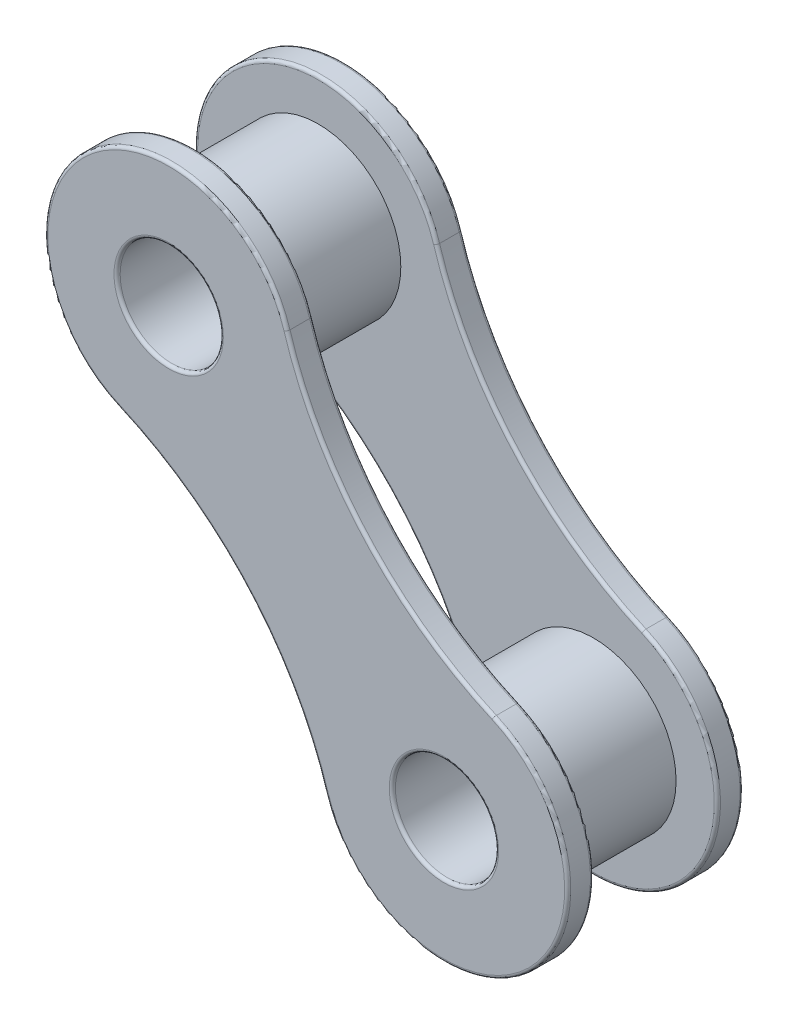
from build123d import *

# Parameters (mm, degrees)
SKETCH_4_R        = 4
SKETCH_4_R_2      = 2.5
EXTRUDE_1_DEPTH   = 3
EXTRUDE_1_2_DEPTH = 3
SKETCH_5_R        = 2.5
EXTRUDE_2_DEPTH   = 1.25
FILLET_1_R        = 0.15


with BuildPart() as part:
    # Эскиз4 → Бобышка-Вытянуть1 (new, symmetric)
    with BuildSketch(Plane.XY):
        with Locations((45.153479747, 53.838446064)):
            Circle(SKETCH_4_R)
        with Locations((45.153479747, 53.838446064)):
            Circle(SKETCH_4_R_2, mode=Mode.SUBTRACT)
    extrude(amount=EXTRUDE_1_DEPTH, both=True)



with BuildPart() as body_2:
    # Эскиз4 → Extrude 1 2 (new, symmetric)
    with BuildSketch(Plane.XY):
        with Locations((58.492489618, 38.936405409)):
            Circle(SKETCH_4_R)
        with Locations((58.492489618, 38.936405409)):
            Circle(SKETCH_4_R_2, mode=Mode.SUBTRACT)
    extrude(amount=EXTRUDE_1_2_DEPTH, both=True)


with BuildPart() as part_1:
    add(part.part)

    add(body_2.part)  # Бобышка-Вытянуть2 merges body 2
    # Эскиз5 → Бобышка-Вытянуть2 (add)
    with BuildSketch(Plane.XY.offset(3)):
        with BuildLine():
            ThreePointArc((52.761061598, 37.161375027), (48.978614129, 43.841392763), (42.756804195, 48.337905518))
            ThreePointArc((42.756804195, 48.337905518), (41.151776786, 58.309058261), (50.884907766, 55.613476447))
            ThreePointArc((50.884907766, 55.613476447), (54.667355235, 48.933458711), (60.889165169, 44.436945956))
            ThreePointArc((60.889165169, 44.436945956), (62.494192579, 34.465793213), (52.761061598, 37.161375027))
        make_face()
        with Locations((45.153479747, 53.838446064)):
            Circle(SKETCH_5_R, mode=Mode.SUBTRACT)
        with Locations((58.492489618, 38.936405409)):
            Circle(SKETCH_5_R, mode=Mode.SUBTRACT)
    extrude_2 = extrude(amount=EXTRUDE_2_DEPTH)

    # Зеркальное отражение1: Бобышка-Вытянуть2 across plane
    add(extrude_2.mirror(Plane.XY))

    # Скругление1
    fillet_1_edges = [part_1.edges().sort_by_distance(p)[0] for p in [
        (62.494192579, 34.465793213, -4.25),
        (48.978614129, 43.841392763, -4.25),
        (41.151776786, 58.309058261, -4.25),
        (54.667355235, 48.933458711, -4.25),
        (55.992489618, 38.936405409, -4.25),
        (42.653479747, 53.838446064, -4.25),
        (62.494192579, 34.465793213, -3),
        (54.667355235, 48.933458711, -3),
        (41.151776786, 58.309058261, -3),
        (48.978614129, 43.841392763, -3),
        (62.494192579, 34.465793213, 4.25),
        (54.667355235, 48.933458711, 4.25),
        (41.151776786, 58.309058261, 4.25),
        (48.978614129, 43.841392763, 4.25),
        (62.494192579, 34.465793213, 3),
        (54.667355235, 48.933458711, 3),
        (41.151776786, 58.309058261, 3),
        (48.978614129, 43.841392763, 3),
        (42.653479747, 53.838446064, 4.25),
        (55.992489618, 38.936405409, 4.25),
    ]]
    fillet(fillet_1_edges, radius=FILLET_1_R)


solid = part_1.part
